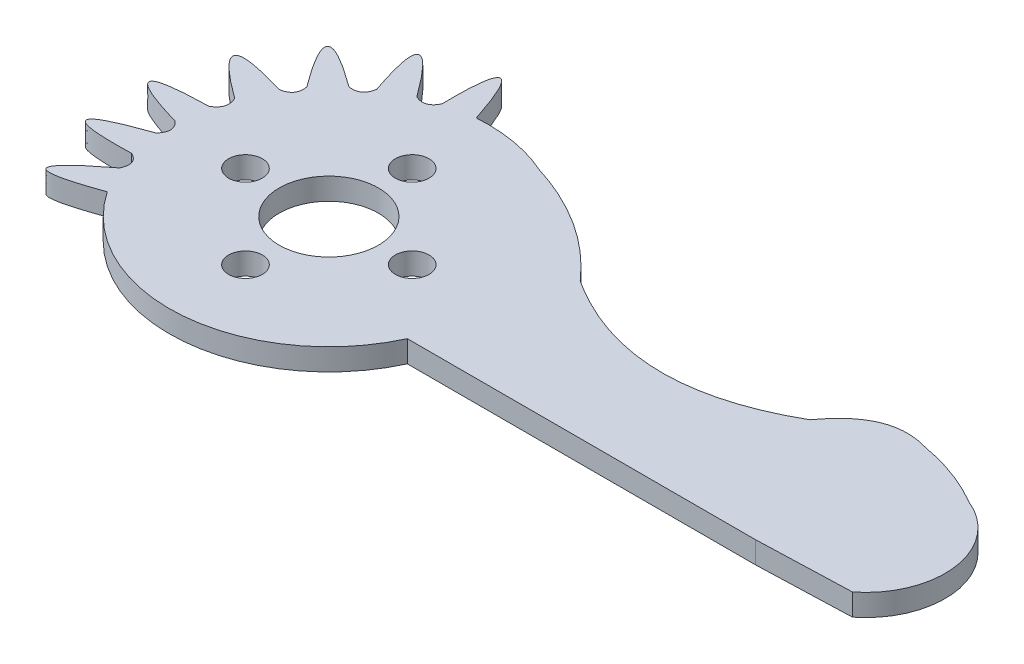
from build123d import *

# Parameters (mm, degrees)
SKETCH_1_R      = 5
SKETCH_1_R_2    = 1.7
EXTRUDE_1_DEPTH = 2.2


with BuildPart() as part:
    # 草图1 → 凸台-拉伸1 (new body)
    with BuildSketch(Plane(origin=(0, 0, 0), x_dir=(1, 0, 0), z_dir=(0, 1, 0))):
        with BuildLine():
            Line((14.611038219, -6.7), (49.690443214, -6.7))
            Line((49.690443214, -6.7), (59.14213471, -6.376451123))
            ThreePointArc((59.14213471, -6.376451123), (62.116009682, 1.036036266), (57.195522798, 7.327118086))
            add(Edge.make_bspline(
                [(50.347107534, 9.880159683), (52.761361064, 9.443859829), (55.044166152, 8.592845964), (57.195522798, 7.327118086)],
                knots=[0.288436631, 0.288436631, 0.288436631, 0.288436631, 1, 1, 1, 1], degree=3))
            add(Edge.make_bspline(
                [(41.984360593, 6.514151987), (43.667045792, 8.848960271), (46.317081673, 10.55679372), (49.303704664, 10.196073302), (50.347107534, 9.880159683)],
                knots=[0.090085046, 0.090085046, 0.090085046, 0.090085046, 0.520368733, 0.736118782, 0.736118782, 0.736118782, 0.736118782], degree=3))
            add(Edge.make_bspline(
                [(18.29395406, 7.037125327), (29.823970963, -0.449921726), (41.984360593, 6.514151987)],
                knots=[0, 0, 0, 1, 1, 1], degree=2))
            add(Edge.make_bspline(
                [(6.555128163, 14.676604942), (13.508953417, 12.492816522), (18.29395406, 7.037125327)],
                knots=[0, 0, 0, 1, 1, 1], degree=2))
            ThreePointArc((6.555128163, 14.676604942), (2.774471684, 15.832711225), (-1.174023286, 16.031035749))
            add(Edge.make_bspline(
                [(-4.132506817, 15.533667476), (-4.311159294, 25.643963381), (-1.174023286, 16.031035749)],
                knots=[0, 0, 0, 1, 1, 1], degree=2))
            add(Edge.make_bspline(
                [(-6.029547406, 14.900234761), (-4.764310754, 14.268430824), (-4.132506817, 15.533667476)],
                knots=[0, 0, 0, 1, 1, 1], degree=2))
            add(Edge.make_bspline(
                [(-8.69333509, 13.520294481), (-11.961242179, 23.089556901), (-6.029547406, 14.900234761)],
                knots=[0, 0, 0, 1, 1, 1], degree=2))
            add(Edge.make_bspline(
                [(-10.305043141, 12.336065974), (-8.907074862, 12.122326202), (-8.69333509, 13.520294481)],
                knots=[0, 0, 0, 1, 1, 1], degree=2))
            add(Edge.make_bspline(
                [(-12.417884822, 10.206300721), (-18.460681491, 18.31398895), (-10.305043141, 12.336065974)],
                knots=[0, 0, 0, 1, 1, 1], degree=2))
            add(Edge.make_bspline(
                [(-13.589217783, 8.585196439), (-12.192999161, 8.810082099), (-12.417884822, 10.206300721)],
                knots=[0, 0, 0, 1, 1, 1], degree=2))
            add(Edge.make_bspline(
                [(-15.07242577, 5.585196439), (-23.295073991, 11.517146599), (-13.589217783, 8.585196439)],
                knots=[0, 0, 0, 1, 1, 1], degree=2))
            add(Edge.make_bspline(
                [(-15.669039675, 3.585196439), (-14.412461062, 4.29933734), (-15.07242577, 5.585196439)],
                knots=[0, 0, 0, 1, 1, 1], degree=2))
            add(Edge.make_bspline(
                [(-16.063311706, 0.585196439), (-25.780917218, 3.388231532), (-15.669039675, 3.585196439)],
                knots=[0, 0, 0, 1, 1, 1], degree=2))
            add(Edge.make_bspline(
                [(-16.011582331, -1.414803561), (-15.037875075, -0.394118455), (-16.063311706, 0.585196439)],
                knots=[0, 0, 0, 1, 1, 1], degree=2))
            add(Edge.make_bspline(
                [(-15.455806267, -4.414803561), (-25.566384923, -4.736394924), (-16.011582331, -1.414803561)],
                knots=[0, 0, 0, 1, 1, 1], degree=2))
            add(Edge.make_bspline(
                [(-14.787919584, -6.299989859), (-14.179269776, -5.023453369), (-15.455806267, -4.414803561)],
                knots=[0, 0, 0, 1, 1, 1], degree=2))
            add(Edge.make_bspline(
                [(-13.318124412, -9), (-22.835991784, -12.431149783), (-14.787919584, -6.299989859)],
                knots=[0, 0, 0, 1, 1, 1], degree=2))
            ThreePointArc((-13.318124412, -9), (1.319244681, -16.019738803), (14.611038219, -6.7))
        make_face()
        with Locations(Location((0, 0, 0), (0, 0, 270))):
            Circle(SKETCH_1_R, mode=Mode.SUBTRACT)
        with Locations(Location((0, 8.4, 0), (0, 0, 270))):
            Circle(SKETCH_1_R_2, mode=Mode.SUBTRACT)
        with Locations(Location((8.4, 0, 0), (0, 0, 270))):
            Circle(SKETCH_1_R_2, mode=Mode.SUBTRACT)
        with Locations(Location((-8.4, 0, 0), (0, 0, 270))):
            Circle(SKETCH_1_R_2, mode=Mode.SUBTRACT)
        with Locations(Location((0, -8.4, 0), (0, 0, 270))):
            Circle(SKETCH_1_R_2, mode=Mode.SUBTRACT)
    extrude(amount=EXTRUDE_1_DEPTH)


solid = part.part
